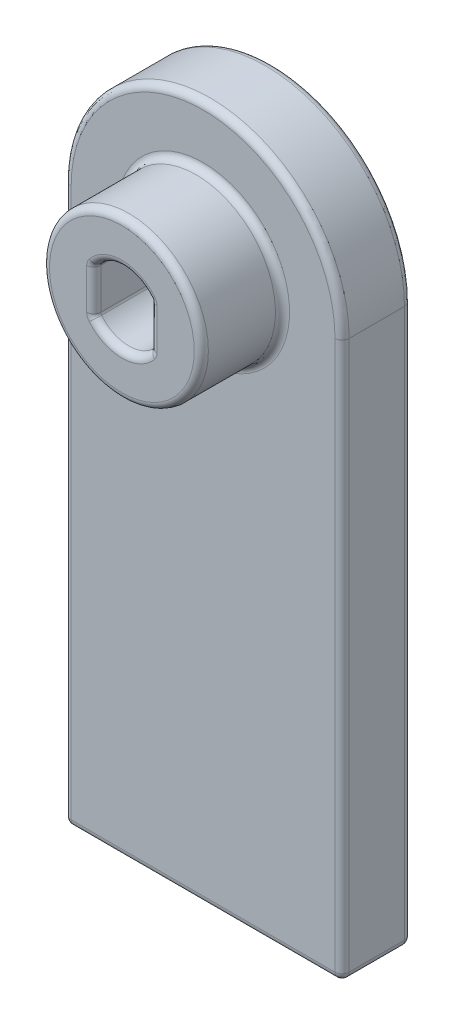
from build123d import *

# Parameters (mm, degrees)
BOSS_EXTRUDE1_DEPTH = 5
SKETCH2_R           = 5.715
BOSS_EXTRUDE2_DEPTH = 5.842
CUT_EXTRUDE1_REACH  = 43.643
FILLET1_R           = 0.508


with BuildPart() as part:
    # Sketch1 → Boss-Extrude1 (new body)
    with BuildSketch(Plane.XY):
        with BuildLine():
            Line((-10, 0), (-10, -40))
            Line((-10, -40), (10, -40))
            Line((10, -40), (10, 0))
            ThreePointArc((10, 0), (0, 10), (-10, 0))
        make_face()
    extrude(amount=BOSS_EXTRUDE1_DEPTH)

    # Sketch2 → Boss-Extrude2 (add)
    with BuildSketch(Plane.XY.offset(5)):
        with Locations(Location((0, 0, 0), (0, 0, 180))):
            Circle(SKETCH2_R)
        with BuildLine():
            Line((2.025, 1.461223802), (2.025, -1.461223802))
            ThreePointArc((2.025, -1.461223802), (2.010039605, -1.547107835), (1.966920732, -1.622874867))
            ThreePointArc((1.966920732, -1.622874867), (0, -2.55), (-1.966920732, -1.622874867))
            ThreePointArc((-1.966920732, -1.622874867), (-2.010039605, -1.547107835), (-2.025, -1.461223802))
            Line((-2.025, -1.461223802), (-2.025, 1.461223802))
            ThreePointArc((-2.025, 1.461223802), (-2.010039605, 1.547107835), (-1.966920732, 1.622874867))
            ThreePointArc((-1.966920732, 1.622874867), (0, 2.55), (1.966920732, 1.622874867))
            ThreePointArc((1.966920732, 1.622874867), (2.010039605, 1.547107835), (2.025, 1.461223802))
        make_face(mode=Mode.SUBTRACT)
    extrude(amount=BOSS_EXTRUDE2_DEPTH)

    # Sketch3 → Cut-Extrude1 (cut, up to next)
    with BuildSketch(Plane.XY.offset(5), mode=Mode.PRIVATE) as cut_extrude1_sk1:
        with BuildLine():
            Line((-2.025, 1.461223802), (-2.025, -1.461223802))
            ThreePointArc((-2.025, -1.461223802), (-2.010039605, -1.547107835), (-1.966920732, -1.622874867))
            ThreePointArc((-1.966920732, -1.622874867), (0, -2.55), (1.966920732, -1.622874867))
            ThreePointArc((1.966920732, -1.622874867), (2.010039605, -1.547107835), (2.025, -1.461223802))
            Line((2.025, -1.461223802), (2.025, 1.461223802))
            ThreePointArc((2.025, 1.461223802), (2.010039605, 1.547107835), (1.966920732, 1.622874867))
            ThreePointArc((1.966920732, 1.622874867), (0, 2.55), (-1.966920732, 1.622874867))
            ThreePointArc((-1.966920732, 1.622874867), (-2.010039605, 1.547107835), (-2.025, 1.461223802))
        make_face()
    cut_extrude1_tool1 = extrude(cut_extrude1_sk1.sketch, amount=-CUT_EXTRUDE1_REACH, mode=Mode.PRIVATE) & part.part
    add(cut_extrude1_tool1.solids().sort_by_distance((0, 0, 5))[0], mode=Mode.SUBTRACT)

    # Fillet1
    fillet1_edges = [part.edges().sort_by_distance(p)[0] for p in [
        (0, -40, 5),
        (10, -20, 5),
        (5.715, 0, 5),
        (5.715, 0, 10.842),
        (-2.010039605, -1.547107835, 10.842),
        (0, -2.55, 10.842),
        (2.010039605, -1.547107835, 10.842),
        (2.025, 0, 10.842),
        (2.010039605, 1.547107835, 10.842),
        (0, 2.55, 10.842),
        (-2.010039605, 1.547107835, 10.842),
        (-2.025, 0, 10.842),
        (-2.010039605, 1.547107835, 0),
        (0, 2.55, 0),
        (2.010039605, 1.547107835, 0),
        (2.025, 0, 0),
        (2.010039605, -1.547107835, 0),
        (0, -2.55, 0),
        (-2.010039605, -1.547107835, 0),
        (-2.025, 0, 0),
        (0, 10, 5),
        (10, -20, 0),
        (0, -40, 0),
        (-10, -20, 0),
        (0, 10, 0),
        (10, -40, 2.5),
        (-10, -40, 2.5),
        (-10, -20, 5),
    ]]
    fillet(fillet1_edges, radius=FILLET1_R)


solid = part.part
